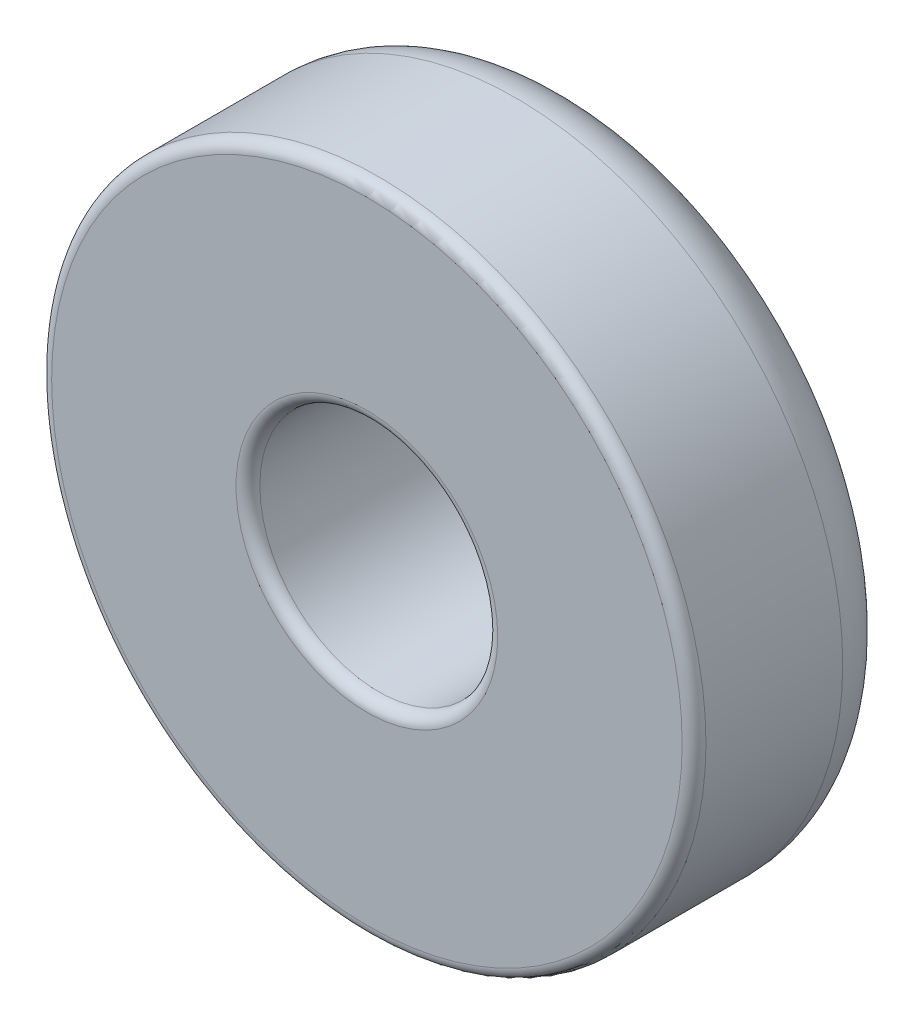
from build123d import *

# Parameters (mm, degrees)
SKETCH1_R           = 2.75
SKETCH1_R_2         = 1
EXTRUDE_THIN1_DEPTH = 1.75
FILLET1_R           = 0.1
FILLET2_R           = 0.5
SCALE1_SCALE        = 0.445


with BuildPart() as part:
    # Sketch1 → Extrude-Thin1 (new body)
    with BuildSketch(Plane.XY):
        Circle(SKETCH1_R)
        Circle(SKETCH1_R_2, mode=Mode.SUBTRACT)
    extrude(amount=EXTRUDE_THIN1_DEPTH)

    # Fillet1
    fillet1_edges = [part.edges().sort_by_distance(p)[0] for p in [
        (-2.75, 0, 1.75),
        (-1, 0, 0),
        (-1, 0, 1.75),
    ]]
    fillet(fillet1_edges, radius=FILLET1_R)

    # Fillet2
    fillet2_edges = [part.edges().sort_by_distance(p)[0] for p in [
        (-2.75, 0, 0),
    ]]
    fillet(fillet2_edges, radius=FILLET2_R)


with BuildPart() as part_1:
    # Scale1: scaled about (0, 0, 0)
    add(part.part.scale(SCALE1_SCALE))


solid = part_1.part
